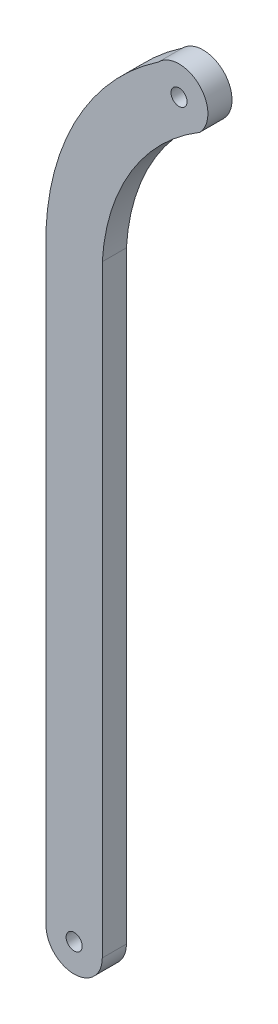
from build123d import *

# Parameters (mm, degrees)
BOSS_EXTRU_1_DEPTH            = 3
TROU_DE_PASSAGE_D_AXE_3_321_D = 2
TROU_DE_PASSAGE_D_AXE_3_322_D = 2


with BuildPart() as part:
    # Esquisse1 → Boss.-Extru.1 (new body)
    with BuildSketch(Plane.XY):
        with BuildLine():
            Line((0, 44.592200572), (0, -30.407799428))
            ThreePointArc((0, -30.407799428), (3.5, -33.907799428), (7, -30.407799428))
            Line((7, -30.407799428), (7, 44.592200572))
            ThreePointArc((7, 44.592200572), (10.5782573, 56.097095666), (19.122245191, 64.592200572))
            ThreePointArc((19.122245191, 64.592200572), (19.045221408, 69.669224354), (13.968197626, 69.592200572))
            ThreePointArc((13.968197626, 69.592200572), (4.030461038, 58.742480417), (0, 44.592200572))
        make_face()
    extrude(amount=BOSS_EXTRU_1_DEPTH)

    # Trou de passage d'axe 3/321 (through all)
    with Locations(Plane(origin=(16.545221408, 67.092200572, 3), x_dir=(1, 0, 0), z_dir=(0, 0, 1))):
        with Locations((0, 0)):
            Hole(TROU_DE_PASSAGE_D_AXE_3_321_D / 2)

    # Trou de passage d'axe 3/322 (through all)
    with Locations(Plane(origin=(3.5, -30.407799428, 3), x_dir=(1, 0, 0), z_dir=(0, 0, 1))):
        with Locations((0, 0)):
            Hole(TROU_DE_PASSAGE_D_AXE_3_322_D / 2)


solid = part.part
